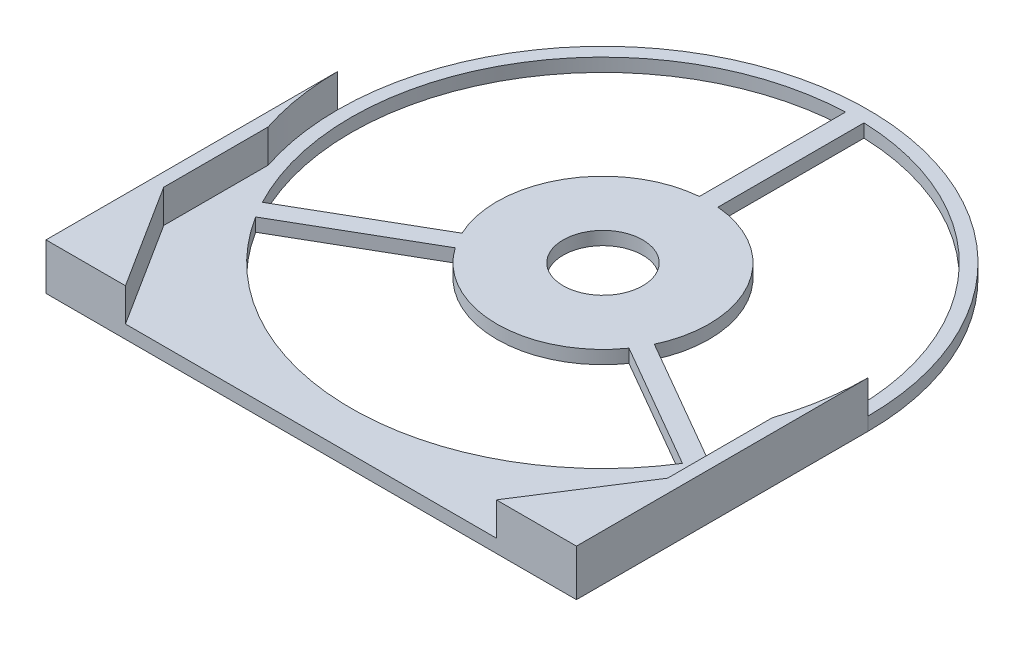
from build123d import *

# Parameters (mm, degrees)
EXTRUDE_4_DEPTH     = 1
EXTRUDE_5_DEPTH     = 2.5
CUT_EXTRUDE_2_DEPTH = 30.837057496
SKETCH_6_R          = 3
CUT_EXTRUDE_3_DEPTH = 30.837057496
SKETCH_7_W          = 38
SKETCH_7_H          = 2.5
CUT_EXTRUDE_4_DEPTH = 47.650294747
EXTRUDE_6_DEPTH     = 2.5


with BuildPart() as part:
    # 草图1 → 凸台-拉伸4 (new body)
    with BuildSketch(Plane(origin=(0, 0, 0), x_dir=(1, 0, 0), z_dir=(0, 1, 0))):
        with BuildLine():
            ThreePointArc((20, 0), (0, 20), (-20, 0))
            Line((-20, 0), (20, 0))
        make_face()
        with BuildLine():
            Line((20, 0), (-20, 0))
            ThreePointArc((-20, 0), (0, -20), (20, 0))
        make_face()
        with BuildLine():
            ThreePointArc((20, 0), (0, -20), (-20, 0))
            Line((-20, 0), (-20, -22))
            Line((-20, -22), (20, -22))
            Line((20, -22), (20, 0))
        make_face()
    extrude(amount=EXTRUDE_4_DEPTH)

    # 草图4 → 凸台-拉伸5 (add)
    with BuildSketch(Plane(origin=(0, 1, 0), x_dir=(1, 0, 0), z_dir=(0, 1, 0))):
        with BuildLine():
            ThreePointArc((20, 0), (0, -20), (-20, 0))
            Line((-20, 0), (-20, -22))
            Line((-20, -22), (20, -22))
            Line((20, -22), (20, 0))
        make_face()
    extrude(amount=EXTRUDE_5_DEPTH)

    # 草图5 → 切除-拉伸2 (cut, through all)
    with BuildSketch(Plane(origin=(0, 1, 0), x_dir=(1, 0, 0), z_dir=(0, 1, 0))):
        with BuildLine():
            ThreePointArc((-7.251630242, -3.378440296), (-6.92820323, 4), (-0.7, 7.969316156))
            Line((-0.7, 7.969316156), (-0.7, 18.987100885))
            ThreePointArc((-0.7, 18.987100885), (-16.454482672, 9.5), (-16.79331171, -8.88733266))
            Line((-16.79331171, -8.88733266), (-7.251630242, -3.378440296))
        make_face()
        with BuildLine():
            ThreePointArc((8, 0), (7.810667127, -1.730167342), (7.251630242, -3.378440296))
            Line((7.251630242, -3.378440296), (16.79331171, -8.88733266))
            ThreePointArc((16.79331171, -8.88733266), (18.440077582, -4.578595718), (19, 0))
            ThreePointArc((19, 0), (13.680277775, 13.185218997), (0.7, 18.987100885))
            Line((0.7, 18.987100885), (0.7, 7.969316156))
            ThreePointArc((0.7, 7.969316156), (5.899152482, 5.403702434), (8, 0))
        make_face()
        with BuildLine():
            Line((16.09331171, -10.099768225), (6.551630242, -4.590875861))
            ThreePointArc((6.551630242, -4.590875861), (0, -8), (-6.551630242, -4.590875861))
            Line((-6.551630242, -4.590875861), (-16.09331171, -10.099768225))
            ThreePointArc((-16.09331171, -10.099768225), (0, -19), (16.09331171, -10.099768225))
        make_face()
    extrude(amount=-CUT_EXTRUDE_2_DEPTH, mode=Mode.SUBTRACT)

    # 草图6 → 切除-拉伸3 (cut, through all)
    with BuildSketch(Plane(origin=(0, 1, 0), x_dir=(1, 0, 0), z_dir=(0, 1, 0))):
        with Locations(Location((0, 0, 0), (0, 0, 270))):
            Circle(SKETCH_6_R)
    extrude(amount=-CUT_EXTRUDE_3_DEPTH, mode=Mode.SUBTRACT)

    # 草图7 → 切除-拉伸4 (cut, through all)
    with BuildSketch(Plane.XY.offset(22)):
        with Locations((0, 2.25)):
            Rectangle(SKETCH_7_W, SKETCH_7_H)
    extrude(amount=-CUT_EXTRUDE_4_DEPTH, mode=Mode.SUBTRACT)

    # 草图8 → 凸台-拉伸6 (add)
    with BuildSketch(Plane(origin=(0, 1, 0), x_dir=(1, 0, 0), z_dir=(0, 1, 0))):
        Polygon((19, -14.122498999), (13.960934911, -22), (19, -22), align=None)
        Polygon((-19, -14.122498999), (-14.007707412, -22), (-19, -22), align=None)
    extrude(amount=EXTRUDE_6_DEPTH)


solid = part.part
